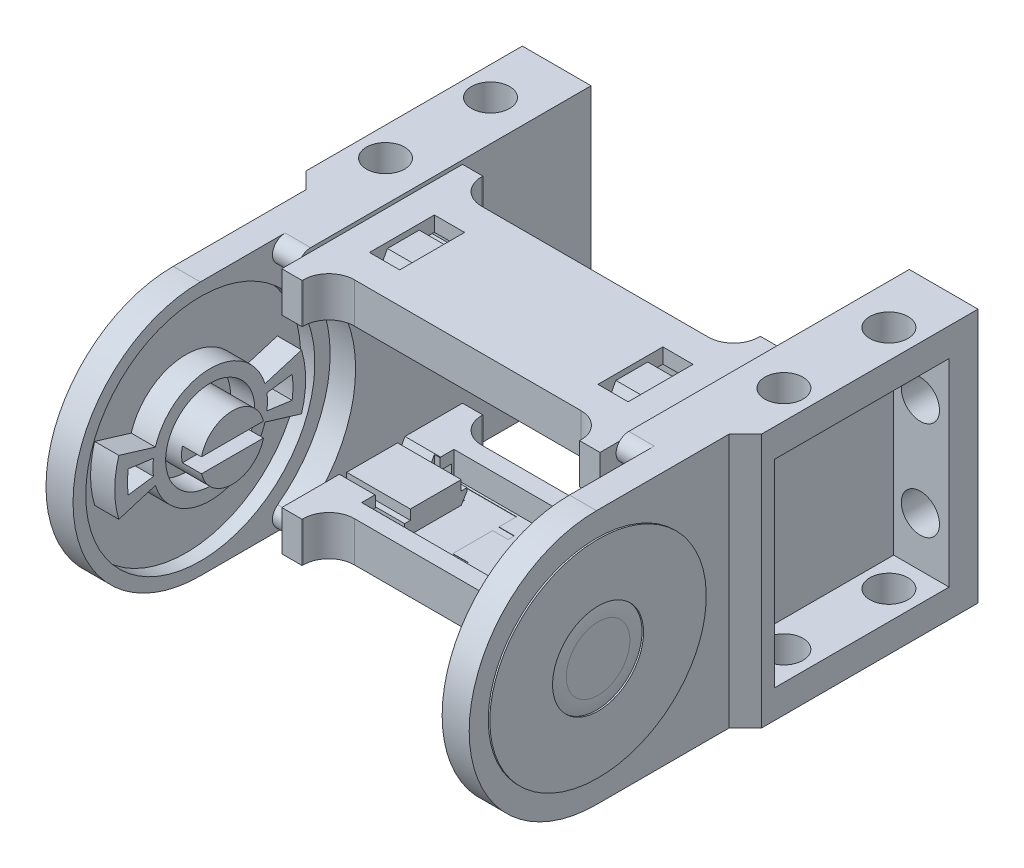
from build123d import *

# Parameters (mm, degrees)
SKETCH1_R            = 5
BOSS_EXTRUDE1_DEPTH  = 2
SKETCH2_RX           = 17
SKETCH2_RY           = 16.25
SKETCH2_R            = 7.15
BOSS_EXTRUDE2_DEPTH  = 0.25
BOSS_EXTRUDE3_START  = 2.25
SKETCH3_R            = 18
BOSS_EXTRUDE3_DEPTH  = 2.25
SKETCH5_R            = 7
BOSS_EXTRUDE4_DEPTH  = 3.8
BOSS_EXTRUDE5_DEPTH  = 4
BOSS_EXTRUDE11_START = 4.25
BOSS_EXTRUDE11_DEPTH = 4.25
BOSS_EXTRUDE12_DEPTH = 40
SKETCH26_W           = 27.4
SKETCH26_H           = 31.1
CUT_EXTRUDE8_DEPTH   = 8.7
SKETCH28_R           = 3
CUT_EXTRUDE9_DEPTH   = 79.590075709
CUT_EXTRUDE10_REACH  = 89.592
SKETCH29_R           = 3
BOSS_EXTRUDE8_DEPTH  = 10
BOSS_EXTRUDE9_DEPTH  = 4.3
SKETCH17_W           = 4.75
SKETCH17_H           = 10.2
BOSS_EXTRUDE10_DEPTH = 6.3
SKETCH18_W           = 13.78
SKETCH18_H           = 2.15
CUT_EXTRUDE3_DEPTH   = 15.8
CUT_EXTRUDE4_DEPTH   = 11.25
CUT_EXTRUDE5_START   = -3.95
SKETCH20_W           = 7
SKETCH20_H           = 1
CUT_EXTRUDE5_DEPTH   = 3.95
SKETCH21_W           = 38.8
SKETCH21_H           = 14.5
CUT_EXTRUDE6_DEPTH   = 3.9
SKETCH24_W           = 10
SKETCH24_H           = 2.3
CUT_EXTRUDE7_DEPTH   = 3


with BuildPart() as part:
    # Sketch1 → Boss-Extrude1 (new body)
    with BuildSketch(Plane(origin=(31.25, 0, 0), x_dir=(0, 0, -1), z_dir=(1, 0, 0))):
        with BuildLine():
            Line((0, 20), (30.582801811, 20))
            ThreePointArc((30.582801811, 20), (32.458698221, 18.693550761), (31.883831194, 16.481012658))
            ThreePointArc((31.883831194, 16.481012658), (24.3, 0), (31.883831194, -16.481012658))
            ThreePointArc((31.883831194, -16.481012658), (32.458698221, -18.693550761), (30.582801811, -20))
            Line((30.582801811, -20), (0, -20))
            ThreePointArc((0, -20), (-20, 0), (0, 20))
        make_face()
        Circle(SKETCH1_R, mode=Mode.SUBTRACT)
    extrude(amount=BOSS_EXTRUDE1_DEPTH)

    # Sketch2 → Boss-Extrude2 (add)
    with BuildSketch(Plane(origin=(33.25, 0, 0), x_dir=(0, 0, -1), z_dir=(1, 0, 0))):
        with Locations(Location((0, 0), (0, 0, 180))):
            Ellipse(SKETCH2_RX, SKETCH2_RY)
        Circle(SKETCH2_R, mode=Mode.SUBTRACT)
    extrude(amount=BOSS_EXTRUDE2_DEPTH)

    # Sketch3 → Boss-Extrude3 (add)
    with BuildSketch(Plane.ZY.offset(-31.25).offset(BOSS_EXTRUDE3_START)):
        with BuildLine():
            Line((-30.582801811, -20), (0, -20))
            ThreePointArc((0, -20), (20, 0), (0, 20))
            Line((0, 20), (-30.582801811, 20))
            ThreePointArc((-30.582801811, 20), (-32.458698221, 18.693550761), (-31.883831194, 16.481012658))
            ThreePointArc((-31.883831194, 16.481012658), (-24.3, 0), (-31.883831194, -16.481012658))
            ThreePointArc((-31.883831194, -16.481012658), (-32.458698221, -18.693550761), (-30.582801811, -20))
        make_face()
        Circle(SKETCH3_R, mode=Mode.SUBTRACT)
    extrude(amount=-BOSS_EXTRUDE3_DEPTH)

    # Sketch5 → Boss-Extrude4 (add)
    with BuildSketch(Plane.ZY.offset(-31.25)):
        with BuildLine():
            Line((-8.613239809, 2.61), (-14.355399681, 4.35))
            ThreePointArc((-14.355399681, 4.35), (-15, 0), (-14.355399681, -4.35))
            Line((-14.355399681, -4.35), (-8.613239809, -2.61))
            ThreePointArc((-8.613239809, -2.61), (0, -9), (8.613239809, -2.61))
            Line((8.613239809, -2.61), (14.355399681, -4.35))
            ThreePointArc((14.355399681, -4.35), (15, 0), (14.355399681, 4.35))
            Line((14.355399681, 4.35), (8.613239809, 2.61))
            ThreePointArc((8.613239809, 2.61), (0, 9), (-8.613239809, 2.61))
        make_face()
        with Locations(Location((0, 0, 0), (0, 0, 180))):
            Circle(SKETCH5_R, mode=Mode.SUBTRACT)
        with BuildLine():
            Line((-12.877930704, 1.777329677), (-8.915490487, 1.230459007))
            ThreePointArc((-8.915490487, 1.230459007), (-9, 0), (-8.915490487, -1.230459007))
            Line((-8.915490487, -1.230459007), (-12.877930704, -1.777329677))
            ThreePointArc((-12.877930704, -1.777329677), (-13, 0), (-12.877930704, 1.777329677))
        make_face(mode=Mode.SUBTRACT)
        with BuildLine():
            Line((12.877930704, -1.777329677), (8.915490487, -1.230459007))
            ThreePointArc((8.915490487, -1.230459007), (9, 0), (8.915490487, 1.230459007))
            Line((8.915490487, 1.230459007), (12.877930704, 1.777329677))
            ThreePointArc((12.877930704, 1.777329677), (13, 0), (12.877930704, -1.777329677))
        make_face(mode=Mode.SUBTRACT)
    extrude(amount=BOSS_EXTRUDE4_DEPTH)

    # Sketch6 → Boss-Extrude5 (add)
    with BuildSketch(Plane(origin=(29, 0, 0), x_dir=(0, 0, -1), z_dir=(1, 0, 0))):
        with BuildLine():
            Line((13.33266665, 20), (57.4, 20))
            Line((57.4, 20), (57.4, -20))
            Line((57.4, -20), (13.33266665, -20))
            ThreePointArc((13.33266665, -20), (11.433418679, -18.626783171), (12.142249985, -16.392857143))
            ThreePointArc((12.142249985, -16.392857143), (20.4, 0), (12.142249985, 16.392857143))
            ThreePointArc((12.142249985, 16.392857143), (11.433418679, 18.626783171), (13.33266665, 20))
        make_face()
    extrude(amount=-BOSS_EXTRUDE5_DEPTH)

    # Эскиз6<2> → Boss-Extrude11 (add)
    with BuildSketch(Plane(origin=(29, 0, 0), x_dir=(0, 0, -1), z_dir=(1, 0, 0)).offset(BOSS_EXTRUDE11_START)):
        with BuildLine():
            Line((13.33266665, 20), (57.4, 20))
            Line((57.4, 20), (57.4, -20))
            Line((57.4, -20), (13.33266665, -20))
            ThreePointArc((13.33266665, -20), (11.433418679, -18.626783171), (12.142249985, -16.392857143))
            ThreePointArc((12.142249985, -16.392857143), (20.4, 0), (12.142249985, 16.392857143))
            ThreePointArc((12.142249985, 16.392857143), (11.433418679, 18.626783171), (13.33266665, 20))
        make_face()
    extrude(amount=-BOSS_EXTRUDE11_DEPTH)

    # Sketch25 → Boss-Extrude12 (add)
    with BuildSketch(Plane.XZ.offset(20)):
        Polygon((33.25, -57.4), (35.8, -57.4), (35.8, -23.4), (33.25, -20.85), align=None)
    extrude(amount=-BOSS_EXTRUDE12_DEPTH)

    # Sketch26 → Cut-Extrude8 (cut)
    with BuildSketch(Plane(origin=(35.8, 0, 0), x_dir=(0, 0, -1), z_dir=(1, 0, 0))):
        with Locations((39.15, 0)):
            Rectangle(SKETCH26_W, SKETCH26_H)
    extrude(amount=-CUT_EXTRUDE8_DEPTH, mode=Mode.SUBTRACT)

    # Sketch28 → Cut-Extrude9 (cut, through all)
    with BuildSketch(Plane(origin=(0, 20, 0), x_dir=(1, 0, 0), z_dir=(0, 1, 0))):
        with Locations(Location((31.3, 47.9, 0), (0, 0, 270))):
            Circle(SKETCH28_R)
        with Locations(Location((31.3, 31.4, 0), (0, 0, 270))):
            Circle(SKETCH28_R)
    extrude(amount=-CUT_EXTRUDE9_DEPTH, mode=Mode.SUBTRACT)

    # Sketch29 → Cut-Extrude10 (cut, up to next)
    with BuildSketch(Plane(origin=(0, 0, -57.4), x_dir=(-1, 0, 0), z_dir=(0, 0, -1)), mode=Mode.PRIVATE) as cut_extrude10_sk1:
        with Locations((-31.3, 7.75)):
            Circle(SKETCH29_R)
    cut_extrude10_tool1 = extrude(cut_extrude10_sk1.sketch, amount=-CUT_EXTRUDE10_REACH, mode=Mode.PRIVATE) & part.part
    # Sketch29 → Cut-Extrude10 (cut, up to next)
    with BuildSketch(Plane(origin=(0, 0, -57.4), x_dir=(-1, 0, 0), z_dir=(0, 0, -1)), mode=Mode.PRIVATE) as cut_extrude10_sk2:
        with Locations((-31.3, -7.75)):
            Circle(SKETCH29_R)
    cut_extrude10_tool2 = extrude(cut_extrude10_sk2.sketch, amount=-CUT_EXTRUDE10_REACH, mode=Mode.PRIVATE) & part.part
    add(cut_extrude10_tool1.solids().sort_by_distance((31.3, 7.75, -57.4))[0], mode=Mode.SUBTRACT)
    add(cut_extrude10_tool2.solids().sort_by_distance((31.3, -7.75, -57.4))[0], mode=Mode.SUBTRACT)

    # Sketch11 → Boss-Extrude8 (add)
    with BuildSketch(Plane.ZY.offset(-25)):
        Polygon((-27, 13.4), (-27, 14.94), (-27.9, 14.94), (-27.9, 15.44), (-27, 16.9), (-19, 16.9), (-18.1, 15.44), (-18.1, 14.94), (-19, 14.94), (-19, 13.4), align=None)
        Polygon((-19, -13.4), (-19, -14.94), (-18.1, -14.94), (-18.1, -15.44), (-19, -16.9), (-27, -16.9), (-27.9, -15.44), (-27.9, -14.94), (-27, -14.94), (-27, -13.4), align=None)
    extrude(amount=BOSS_EXTRUDE8_DEPTH)

    # Sketch15 → Boss-Extrude9 (add)
    with BuildSketch(Plane.ZY.offset(-15.8)):
        Polygon((-25.5, 18.75), (-20.5, 18.75), (-19.5, 16.9), (-26.5, 16.9), align=None)
    boss_extrude9 = extrude(amount=-BOSS_EXTRUDE9_DEPTH)

    # Mirror1: Boss-Extrude9 across plane
    add(boss_extrude9.mirror(Plane.ZX))


with BuildPart() as body_2:
    # Mirror2: mirrored copy
    add(part.part.mirror(Plane(origin=(0, 0, 0), x_dir=(0, 0, 1), z_dir=(1, 0, 0))))


with BuildPart() as body_3:
    # Sketch17 → Boss-Extrude10 (new body)
    with BuildSketch(Plane(origin=(0, 19.4, 0), x_dir=(1, 0, 0), z_dir=(0, 1, 0))):
        with BuildLine():
            Line((21.8, 9), (21.8, 8.8))
            Line((21.8, 8.8), (25, 8.8))
            Line((25, 8.8), (25, 37.2))
            Line((25, 37.2), (21.8, 37.2))
            Line((21.8, 37.2), (21.8, 37))
            ThreePointArc((21.8, 37), (20.628427125, 34.171572875), (17.8, 33))
            Line((17.8, 33), (-17.8, 33))
            ThreePointArc((-17.8, 33), (-20.628427125, 34.171572875), (-21.8, 37))
            Line((-21.8, 37), (-21.8, 37.2))
            Line((-21.8, 37.2), (-25, 37.2))
            Line((-25, 37.2), (-25, 8.8))
            Line((-25, 8.8), (-21.8, 8.8))
            Line((-21.8, 8.8), (-21.8, 9))
            ThreePointArc((-21.8, 9), (-20.628427125, 11.828427125), (-17.8, 13))
            Line((-17.8, 13), (17.8, 13))
            ThreePointArc((17.8, 13), (20.628427125, 11.828427125), (21.8, 9))
        make_face()
        with Locations((17.95, 23)):
            Rectangle(SKETCH17_W, SKETCH17_H, mode=Mode.SUBTRACT)
        with Locations((-17.95, 23)):
            Rectangle(SKETCH17_W, SKETCH17_H, mode=Mode.SUBTRACT)
    extrude(amount=-BOSS_EXTRUDE10_DEPTH)

    # Sketch18 → Cut-Extrude3 (cut)
    with BuildSketch(Plane(origin=(25, 0, 0), x_dir=(0, 0, -1), z_dir=(1, 0, 0))):
        with Locations((23, 15.975)):
            Rectangle(SKETCH18_W, SKETCH18_H)
    cut_extrude3 = extrude(amount=-CUT_EXTRUDE3_DEPTH, mode=Mode.SUBTRACT)

    # Sketch19 → Cut-Extrude4 (cut)
    with BuildSketch(Plane(origin=(25, 0, 0), x_dir=(0, 0, -1), z_dir=(1, 0, 0))):
        Polygon((18.8, 14.9), (17.85, 13.1), (28.15, 13.1), (27.2, 14.9), align=None)
    cut_extrude4 = extrude(amount=-CUT_EXTRUDE4_DEPTH, mode=Mode.SUBTRACT)

    # Sketch20 → Cut-Extrude5 (cut)
    with BuildSketch(Plane.XZ.offset(-13.1).offset(CUT_EXTRUDE5_START)):
        with Locations((10.25, -26.625)):
            Rectangle(SKETCH20_W, SKETCH20_H)
        with Locations((10.25, -19.375)):
            Rectangle(SKETCH20_W, SKETCH20_H)
    cut_extrude5 = extrude(amount=CUT_EXTRUDE5_DEPTH, mode=Mode.SUBTRACT)

    # Mirror5: Cut-Extrude3, Cut-Extrude4, Cut-Extrude5 across plane
    add(cut_extrude3.mirror(Plane(origin=(0, 0, 0), x_dir=(0, 0, 1), z_dir=(1, 0, 0))), mode=Mode.SUBTRACT)
    add(cut_extrude4.mirror(Plane(origin=(0, 0, 0), x_dir=(0, 0, 1), z_dir=(1, 0, 0))), mode=Mode.SUBTRACT)
    add(cut_extrude5.mirror(Plane(origin=(0, 0, 0), x_dir=(0, 0, 1), z_dir=(1, 0, 0))), mode=Mode.SUBTRACT)

    # Sketch21 → Cut-Extrude6 (cut)
    with BuildSketch(Plane.XZ.offset(-13.1)):
        with Locations((0, -23)):
            Rectangle(SKETCH21_W, SKETCH21_H)
    extrude(amount=-CUT_EXTRUDE6_DEPTH, mode=Mode.SUBTRACT)


with BuildPart() as body_4:
    # Mirror4: mirrored copy
    add(body_3.part.mirror(Plane.ZX))


with BuildPart() as body_5:
    # Sketch23 → Revolve1 (revolve)
    with BuildSketch(Plane(origin=(0, 0, 0), x_dir=(1, 0, 0), z_dir=(0, 1, 0))):
        with BuildLine():
            Line((-23.95, 0), (-33.5, 0))
            Line((-33.5, 0), (-33.5, 5))
            ThreePointArc((-33.5, 5), (-33.437299523, 6.107079491), (-33.25, 7.2))
            Line((-33.25, 7.2), (-33.25, 5))
            Line((-33.25, 5), (-23.95, 5))
            Line((-23.95, 5), (-23.95, 0))
        make_face()
    revolve(axis=Axis((-23.95, 0, 0), (-1, 0, 0)))

    # Sketch24 → Cut-Extrude7 (cut)
    with BuildSketch(Plane(origin=(-23.95, 0, 0), x_dir=(0, 0, -1), z_dir=(1, 0, 0))):
        Rectangle(SKETCH24_W, SKETCH24_H)
    extrude(amount=-CUT_EXTRUDE7_DEPTH, mode=Mode.SUBTRACT)


with BuildPart() as body_6:
    # Mirror6: mirrored copy
    add(body_5.part.mirror(Plane(origin=(0, 0, 0), x_dir=(0, 0, 1), z_dir=(1, 0, 0))))


solid = Compound([part.part, body_2.part, body_3.part, body_4.part, body_5.part, body_6.part])
